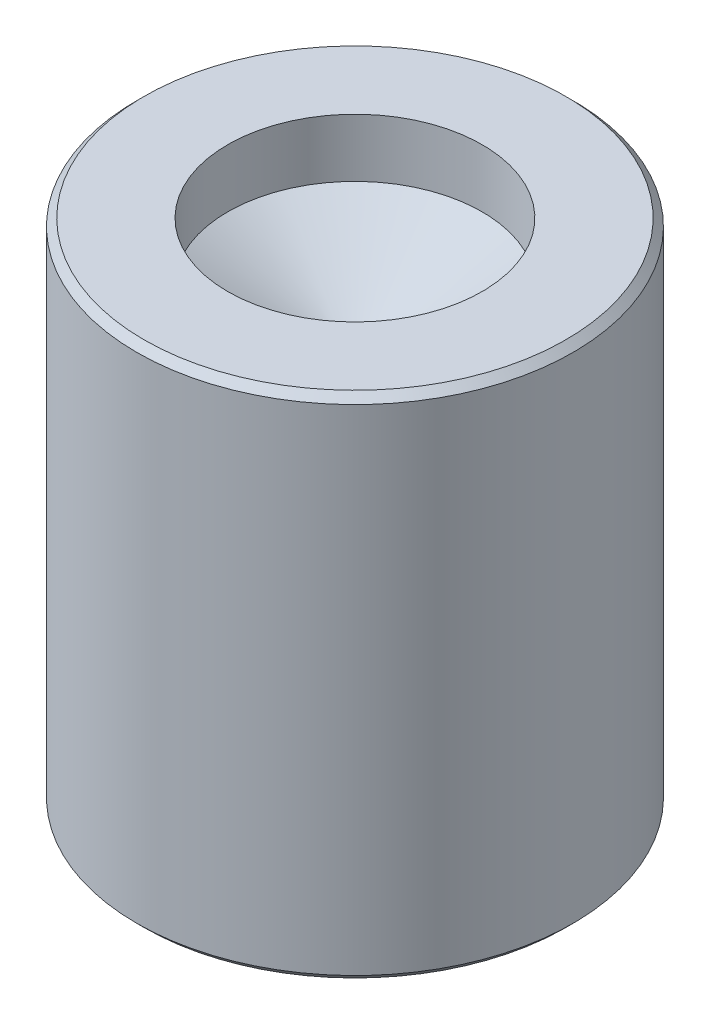
from build123d import *

# Parameters (mm, degrees)
ESQUISSE1_R         = 30
BOSS_EXTRU_1_DEPTH  = 70
D_GAGEMENT_82_D     = 35.000000104
D_GAGEMENT_82_DEPTH = 8
D_GAGEMENT_82_TIP   = 10.515060864
CHANFREIN1_SIZE     = 1


with BuildPart() as part:
    # Esquisse1 → Boss.-Extru.1 (new body)
    with BuildSketch(Plane(origin=(0, 0, 0), x_dir=(1, 0, 0), z_dir=(0, 1, 0))):
        with Locations(Location((0, 0, 0), (0, 0, 270))):
            Circle(ESQUISSE1_R)
    extrude(amount=BOSS_EXTRU_1_DEPTH)

    # Dégagement #82
    with Locations(Plane(origin=(0, 70, 0), x_dir=(1, 0, 0), z_dir=(0, 1, 0))):
        with Locations((0, 0)):
            Hole(D_GAGEMENT_82_D / 2, depth=D_GAGEMENT_82_DEPTH)
            with Locations((0, 0, -(D_GAGEMENT_82_DEPTH + D_GAGEMENT_82_TIP / 2))):  # 118° drill point
                Cone(0, D_GAGEMENT_82_D / 2, D_GAGEMENT_82_TIP, mode=Mode.SUBTRACT)

    # Chanfrein1
    chanfrein1_edges = [part.edges().sort_by_distance(p)[0] for p in [
        (0, 0, -30),
        (0, 70, -30),
    ]]
    chamfer(chanfrein1_edges, length=CHANFREIN1_SIZE)


solid = part.part
